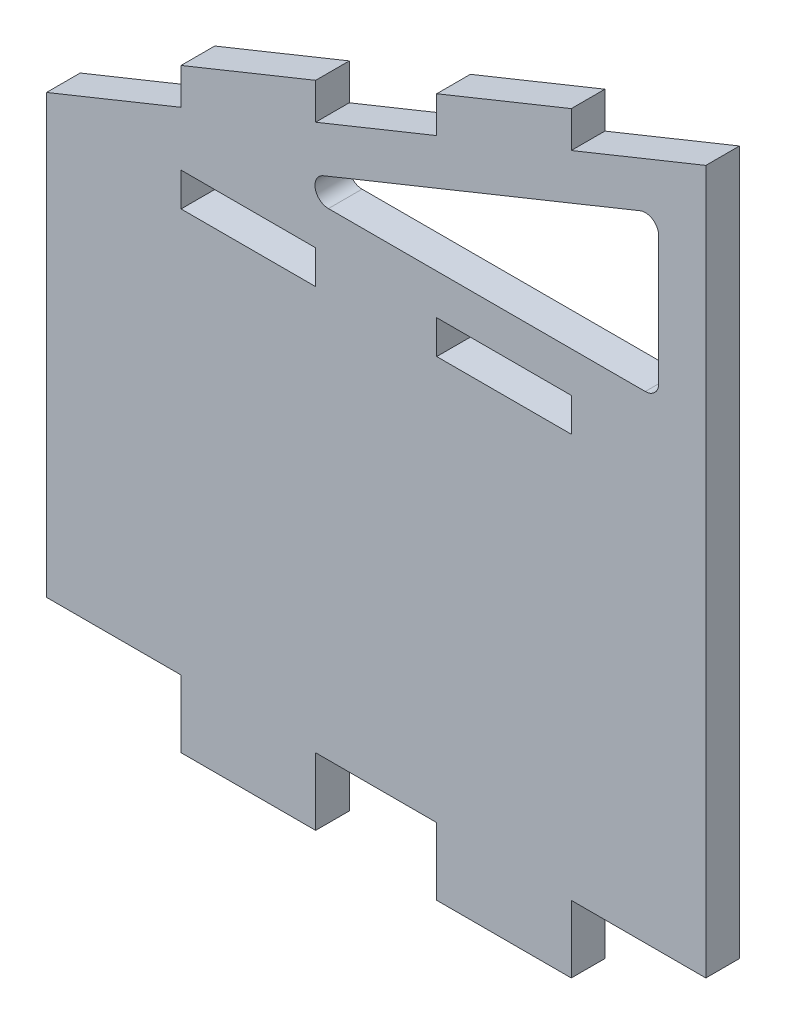
from build123d import *

# Parameters (mm, degrees)
SKETCH1_W           = 10
SKETCH1_H           = 2.5
BOSS_EXTRUDE1_DEPTH = 2.5


with BuildPart() as part:
    # Sketch1 → Boss-Extrude1 (new body)
    with BuildSketch(Plane.XY):
        Polygon((-24.5, -25), (-14.5, -25), (-14.5, -30), (-4.5, -30), (-4.5, -25), (4.5, -25), (4.5, -30), (14.5, -30), (14.5, -25), (24.5, -25), (24.5, 27.303543512), (14.5, 23.26200402), (14.5, 25.958460508), (4.5, 21.916921016), (4.5, 19.220464528), (-4.5, 15.583078984), (-4.5, 18.279535472), (-14.5, 14.23799598), (-14.5, 11.541539492), (-24.5, 7.5), align=None)
        with Locations((-9.5, 6.25)):
            Rectangle(SKETCH1_W, SKETCH1_H, mode=Mode.SUBTRACT)
        with Locations((9.5, 6.25)):
            Rectangle(SKETCH1_W, SKETCH1_H, mode=Mode.SUBTRACT)
        with BuildLine():
            Line((21, 21.017263456), (21, 11.5))
            ThreePointArc((21, 11.5), (20.707106781, 10.792893219), (20, 10.5))
            Line((20, 10.5), (-3.54860932, 10.5))
            ThreePointArc((-3.54860932, 10.5), (-4.530226027, 11.309137116), (-3.923317712, 12.427142719))
            Line((-3.923317712, 12.427142719), (19.625291609, 21.944406175))
            ThreePointArc((19.625291609, 21.944406175), (20.559147391, 21.846331725), (21, 21.017263456))
        make_face(mode=Mode.SUBTRACT)
    extrude(amount=BOSS_EXTRUDE1_DEPTH)


solid = part.part
